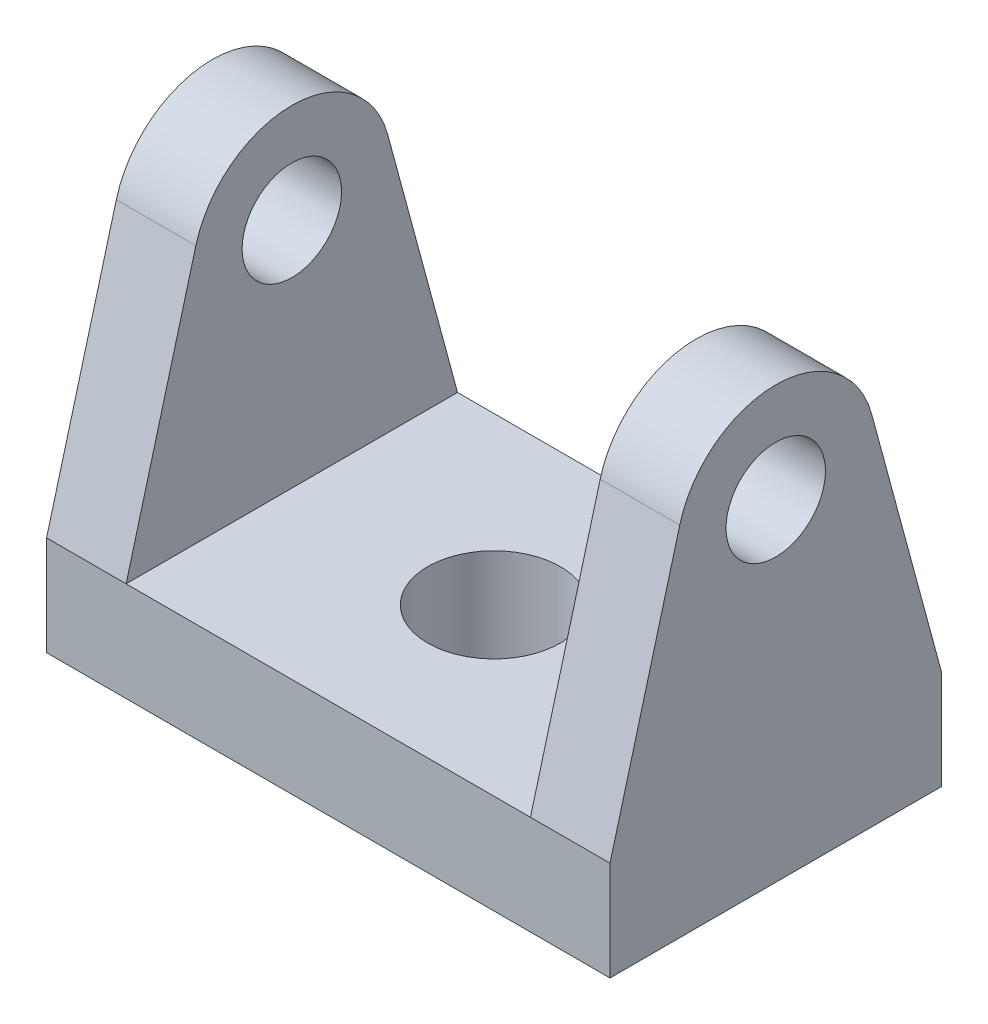
from build123d import *

# Parameters (mm, degrees)
SKETCH1_W           = 85
SKETCH1_H           = 50
SKETCH1_R           = 10
BOSS_EXTRUDE1_DEPTH = 15
SKETCH2_R           = 7.5
BOSS_EXTRUDE2_DEPTH = 12


with BuildPart() as part:
    # Sketch1 → Boss-Extrude1 (new body)
    with BuildSketch(Plane(origin=(0, 0, 0), x_dir=(1, 0, 0), z_dir=(0, 1, 0))):
        Rectangle(SKETCH1_W, SKETCH1_H)
        with Locations(Location((0, 0, 0), (0, 0, 270))):
            Circle(SKETCH1_R, mode=Mode.SUBTRACT)
    extrude(amount=BOSS_EXTRUDE1_DEPTH)

    # Sketch2 → Boss-Extrude2 (add)
    with BuildSketch(Plane.ZY.offset(42.5)):
        with BuildLine():
            Line((-25, 15), (25, 15))
            Line((25, 15), (14.480230589, 53.914450421))
            ThreePointArc((14.480230589, 53.914450421), (0, 65), (-14.480230589, 53.914450421))
            Line((-14.480230589, 53.914450421), (-25, 15))
        make_face()
        with Locations((0, 50)):
            Circle(SKETCH2_R, mode=Mode.SUBTRACT)
    boss_extrude2 = extrude(amount=-BOSS_EXTRUDE2_DEPTH)

    # Mirror1: Boss-Extrude2 across plane
    add(boss_extrude2.mirror(Plane(origin=(0, 0, 0), x_dir=(0, 0, 1), z_dir=(1, 0, 0))))


solid = part.part
